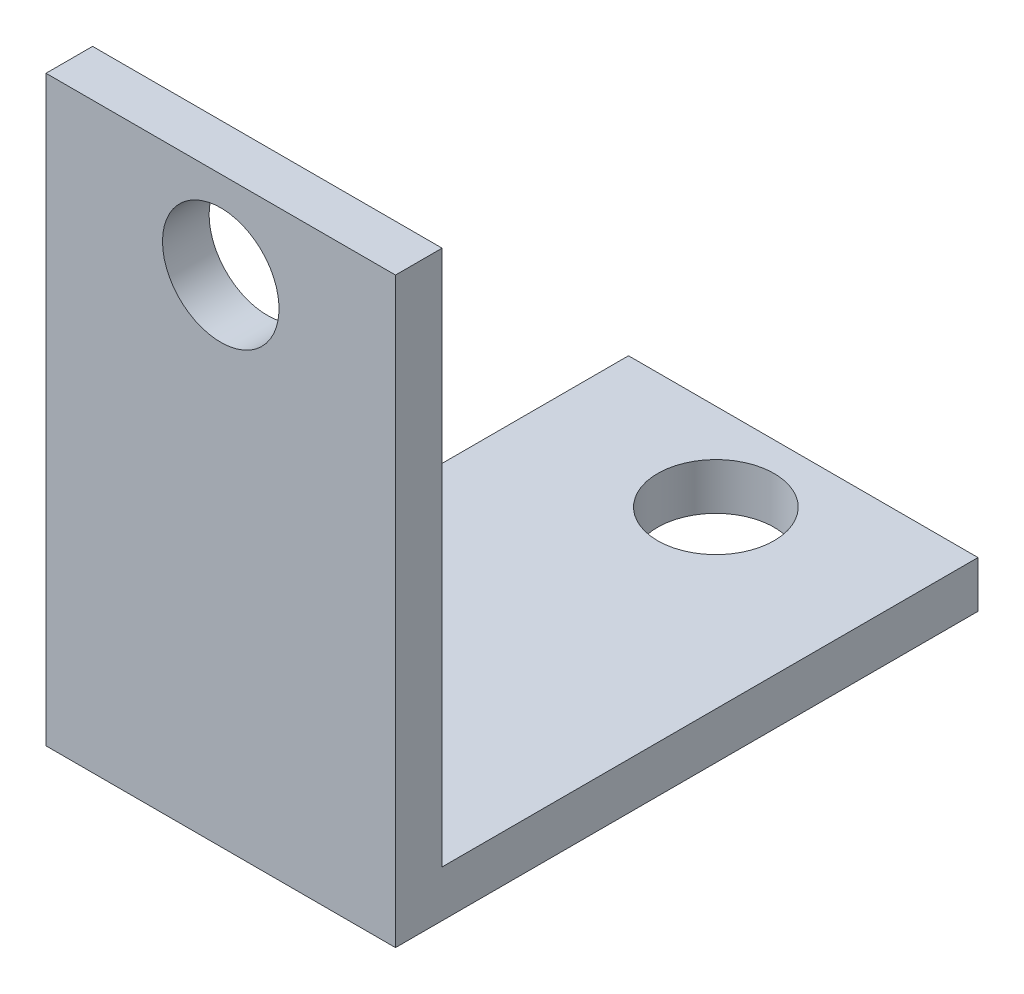
from build123d import *

# Parameters (mm, degrees)
IZIM1_W                     = 15
IZIM1_H                     = 25
IZIM1_R                     = 2.5
Y_KSEKLIK_EKSTR_ZYON1_DEPTH = 2
IZIM2_W                     = 15
IZIM2_H                     = 2
Y_KSEKLIK_EKSTR_ZYON2_DEPTH = 23
IZIM3_R                     = 2.5
KES_EKSTR_ZYON1_DEPTH       = 13


with BuildPart() as part:
    # Çizim1 → Yükseklik-Ekstrüzyon1 (new body)
    with BuildSketch(Plane(origin=(0, 0, 0), x_dir=(1, 0, 0), z_dir=(0, 1, 0))):
        Rectangle(IZIM1_W, IZIM1_H)
        with Locations(Location((0, 8.75, 0), (0, 0, 270))):
            Circle(IZIM1_R, mode=Mode.SUBTRACT)
    extrude(amount=Y_KSEKLIK_EKSTR_ZYON1_DEPTH)

    # Çizim2 → Yükseklik-Ekstrüzyon2 (add)
    with BuildSketch(Plane(origin=(0, 2, 0), x_dir=(1, 0, 0), z_dir=(0, 1, 0))):
        with Locations((0, -11.5)):
            Rectangle(IZIM2_W, IZIM2_H)
    extrude(amount=Y_KSEKLIK_EKSTR_ZYON2_DEPTH)

    # Çizim3 → Kes-Ekstrüzyon1 (cut)
    with BuildSketch(Plane(origin=(0, 0, 10.5), x_dir=(-1, 0, 0), z_dir=(0, 0, -1))):
        with Locations((0, 21.25)):
            Circle(IZIM3_R)
    extrude(amount=-KES_EKSTR_ZYON1_DEPTH, mode=Mode.SUBTRACT)


solid = part.part
